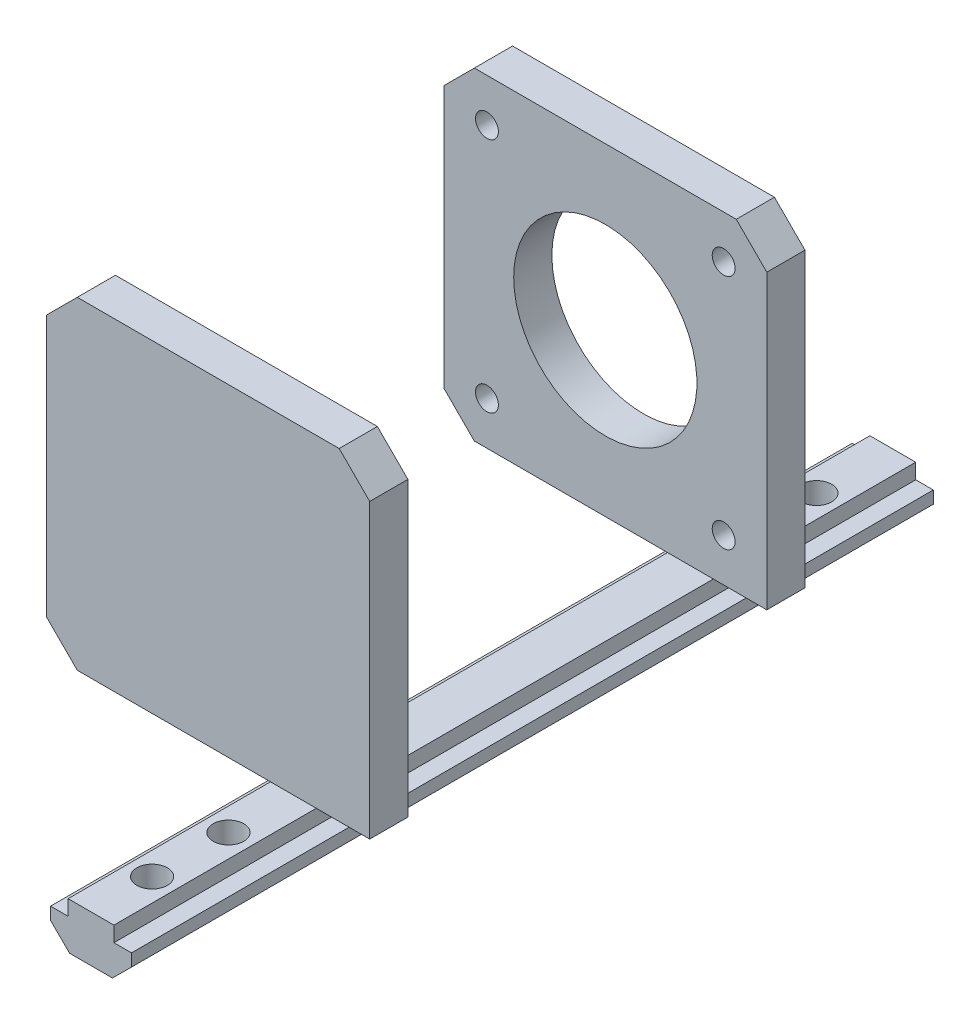
from build123d import *

# Parameters (mm, degrees)
BOSS_EXTRUDE1_DEPTH        = 28.5
BOSS_EXTRUDE2_DEPTH        = 5
CHAMFER1_SIZE              = 4
LPATTERN1_COUNT            = 2
LPATTERN1_PITCH            = 52
CHAMFER1_OF_LPATTERN1_SIZE = 4
CUT_EXTRUDE1_REACH         = 79.984
SKETCH4_R                  = 12
SKETCH4_R_2                = 1.5
BOSS_EXTRUDE3_DEPTH        = 55
BOSS_EXTRUDE3_DEPTH_BACK   = 50
SKETCH6_R                  = 2
CUT_EXTRUDE2_DEPTH         = 77.534828673


with BuildPart() as part:
    # Sketch1 → Boss-Extrude1 (new, symmetric)
    with BuildSketch(Plane.XY):
        Polygon((-3, 0), (3, 0), (3, -2), (5.3, -2), (5.3, -3.62), (2.8, -6.1), (-2.8, -6.1), (-5.3, -3.62), (-5.3, -2), (-3, -2), align=None)
    extrude(amount=BOSS_EXTRUDE1_DEPTH, both=True)

    # Sketch2 → Boss-Extrude2 (add)
    with BuildSketch(Plane(origin=(0, 0, -28.5), x_dir=(-1, 0, 0), z_dir=(0, 0, -1))):
        Polygon((32.3, 0), (32.3, 42.3), (-10, 42.3), (-10, 0), (0, 0), align=None)
    boss_extrude2 = extrude(amount=-BOSS_EXTRUDE2_DEPTH)

    # Chamfer1
    chamfer1_edges = [part.edges().sort_by_distance(p)[0] for p in [
        (-32.3, 0, -26),
        (10, 42.3, -26),
        (-32.3, 42.3, -26),
    ]]
    chamfer(chamfer1_edges, length=CHAMFER1_SIZE)

    # LPattern1: Boss-Extrude2 ×2
    with Locations(*[(0, 0, i * LPATTERN1_PITCH) for i in range(1, LPATTERN1_COUNT)]):
        add(boss_extrude2)

    # Chamfer1 of LPattern1
    chamfer1_of_lpattern1_edges = [part.edges().sort_by_distance(p)[0] for p in [
        (-32.3, 0, 26),
        (10, 42.3, 26),
        (-32.3, 42.3, 26),
    ]]
    chamfer(chamfer1_of_lpattern1_edges, length=CHAMFER1_OF_LPATTERN1_SIZE)

    # Sketch4 → Cut-Extrude1 (cut, up to next)
    with BuildSketch(Plane(origin=(0, 0, -28.5), x_dir=(-1, 0, 0), z_dir=(0, 0, -1)), mode=Mode.PRIVATE) as cut_extrude1_sk1:
        with Locations((11.15, 21.15)):
            Circle(SKETCH4_R)
    cut_extrude1_tool1 = extrude(cut_extrude1_sk1.sketch, amount=-CUT_EXTRUDE1_REACH, mode=Mode.PRIVATE) & part.part
    # Sketch4 → Cut-Extrude1 (cut, up to next)
    with BuildSketch(Plane(origin=(0, 0, -28.5), x_dir=(-1, 0, 0), z_dir=(0, 0, -1)), mode=Mode.PRIVATE) as cut_extrude1_sk2:
        with Locations((26.65, 36.65)):
            Circle(SKETCH4_R_2)
    cut_extrude1_tool2 = extrude(cut_extrude1_sk2.sketch, amount=-CUT_EXTRUDE1_REACH, mode=Mode.PRIVATE) & part.part
    # Sketch4 → Cut-Extrude1 (cut, up to next)
    with BuildSketch(Plane(origin=(0, 0, -28.5), x_dir=(-1, 0, 0), z_dir=(0, 0, -1)), mode=Mode.PRIVATE) as cut_extrude1_sk3:
        with Locations((-4.35, 36.65)):
            Circle(SKETCH4_R_2)
    cut_extrude1_tool3 = extrude(cut_extrude1_sk3.sketch, amount=-CUT_EXTRUDE1_REACH, mode=Mode.PRIVATE) & part.part
    # Sketch4 → Cut-Extrude1 (cut, up to next)
    with BuildSketch(Plane(origin=(0, 0, -28.5), x_dir=(-1, 0, 0), z_dir=(0, 0, -1)), mode=Mode.PRIVATE) as cut_extrude1_sk4:
        with Locations((-4.35, 5.65)):
            Circle(SKETCH4_R_2)
    cut_extrude1_tool4 = extrude(cut_extrude1_sk4.sketch, amount=-CUT_EXTRUDE1_REACH, mode=Mode.PRIVATE) & part.part
    # Sketch4 → Cut-Extrude1 (cut, up to next)
    with BuildSketch(Plane(origin=(0, 0, -28.5), x_dir=(-1, 0, 0), z_dir=(0, 0, -1)), mode=Mode.PRIVATE) as cut_extrude1_sk5:
        with Locations((26.65, 5.65)):
            Circle(SKETCH4_R_2)
    cut_extrude1_tool5 = extrude(cut_extrude1_sk5.sketch, amount=-CUT_EXTRUDE1_REACH, mode=Mode.PRIVATE) & part.part
    add(cut_extrude1_tool1.solids().sort_by_distance((-11.15, 21.15, -28.5))[0], mode=Mode.SUBTRACT)
    add(cut_extrude1_tool2.solids().sort_by_distance((-26.65, 36.65, -28.5))[0], mode=Mode.SUBTRACT)
    add(cut_extrude1_tool3.solids().sort_by_distance((4.35, 36.65, -28.5))[0], mode=Mode.SUBTRACT)
    add(cut_extrude1_tool4.solids().sort_by_distance((4.35, 5.65, -28.5))[0], mode=Mode.SUBTRACT)
    add(cut_extrude1_tool5.solids().sort_by_distance((-26.65, 5.65, -28.5))[0], mode=Mode.SUBTRACT)

    # Sketch5 → Boss-Extrude3 (add, two sides: drawn at the far end of the back side and taken through both)
    with BuildSketch(Plane.XY.offset(-BOSS_EXTRUDE3_DEPTH_BACK)):
        Polygon((-3, -2), (-5.3, -2), (-5.3, -3.62), (-2.8, -6.1), (2.8, -6.1), (5.3, -3.62), (5.3, -2), (3, -2), (3, 0), (-3, 0), align=None)
    extrude(amount=BOSS_EXTRUDE3_DEPTH + BOSS_EXTRUDE3_DEPTH_BACK)

    # Sketch6 → Cut-Extrude2 (cut, through all)
    with BuildSketch(Plane(origin=(0, 0, 0), x_dir=(1, 0, 0), z_dir=(0, 1, 0))):
        with Locations(Location((0, 40, 0), (0, 0, 270))):
            Circle(SKETCH6_R)
        with Locations(Location((0, -37, 0), (0, 0, 270))):
            Circle(SKETCH6_R)
        with Locations(Location((0, -47, 0), (0, 0, 270))):
            Circle(SKETCH6_R)
    extrude(amount=-CUT_EXTRUDE2_DEPTH, mode=Mode.SUBTRACT)


solid = part.part
